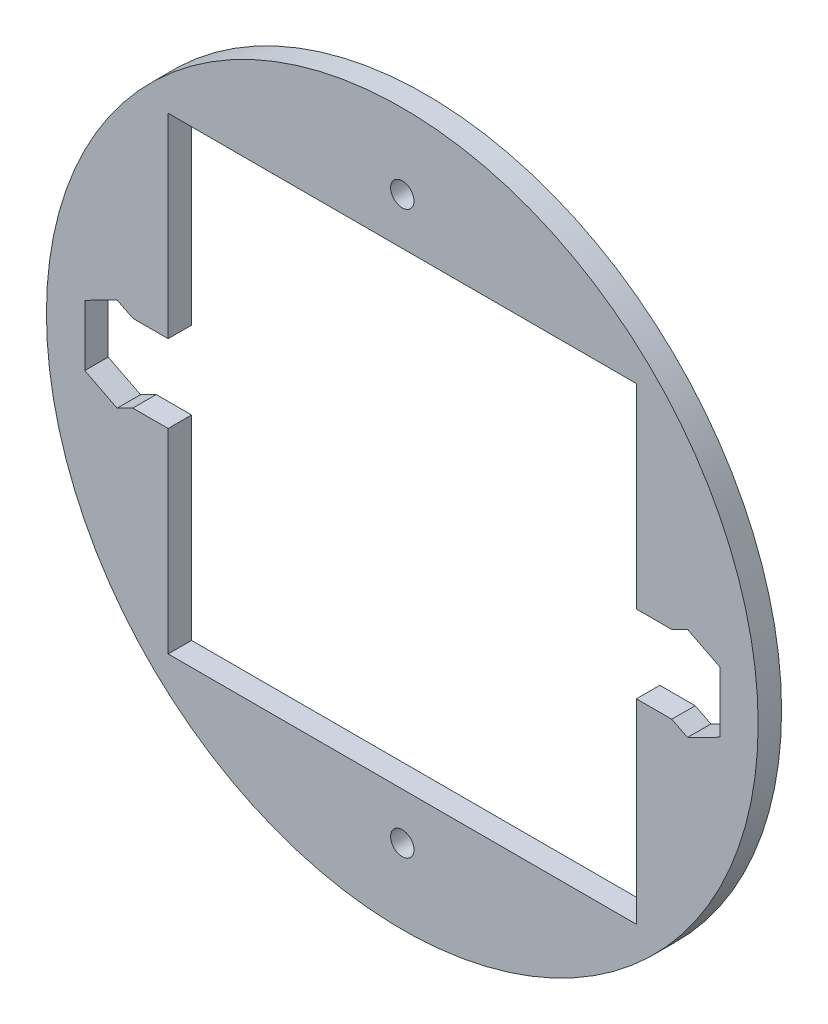
from build123d import *

# Parameters (mm, degrees)
SKETCH1_R          = 76
CIRCLE_DEPTH       = 5
SKETCH2_W          = 100
SKETCH2_H          = 100
SQUARE_DEPTH       = 5
SKETCH3_R          = 2.5
HOLES_DEPTH        = 5
CUT_EXTRUDE3_DEPTH = 5


with BuildPart() as part:
    # Sketch1 → circle (new body)
    with BuildSketch(Plane.XY):
        Circle(SKETCH1_R)
    extrude(amount=CIRCLE_DEPTH)

    # Sketch2 → square (cut)
    with BuildSketch(Plane.XY.offset(5)):
        Rectangle(SKETCH2_W, SKETCH2_H)
    extrude(amount=-SQUARE_DEPTH, mode=Mode.SUBTRACT)

    # Sketch3 → holes (cut)
    with BuildSketch(Plane.XY.offset(5)):
        with Locations((0, 60)):
            Circle(SKETCH3_R)
        with Locations((0, -60)):
            Circle(SKETCH3_R)
    extrude(amount=-HOLES_DEPTH, mode=Mode.SUBTRACT)

    # Sketch4 → Cut-Extrude3 (cut)
    with BuildSketch(Plane.XY.offset(5)):
        Polygon((-50, 0), (-50, -8.3), (-57.55, -8.3), (-60.903744176, -10), (-67.80719259, -6.5), (-67.80719259, 6.5), (-60.903744176, 10), (-57.55, 8.3), (-50, 8.3), align=None)
        Polygon((57.55, 8.3), (50, 8.3), (50, 0), (50, -8.3), (57.55, -8.3), (60.903744176, -10), (67.80719259, -6.5), (67.80719259, 6.5), (60.903744176, 10), align=None)
    extrude(amount=-CUT_EXTRUDE3_DEPTH, mode=Mode.SUBTRACT)


solid = part.part
